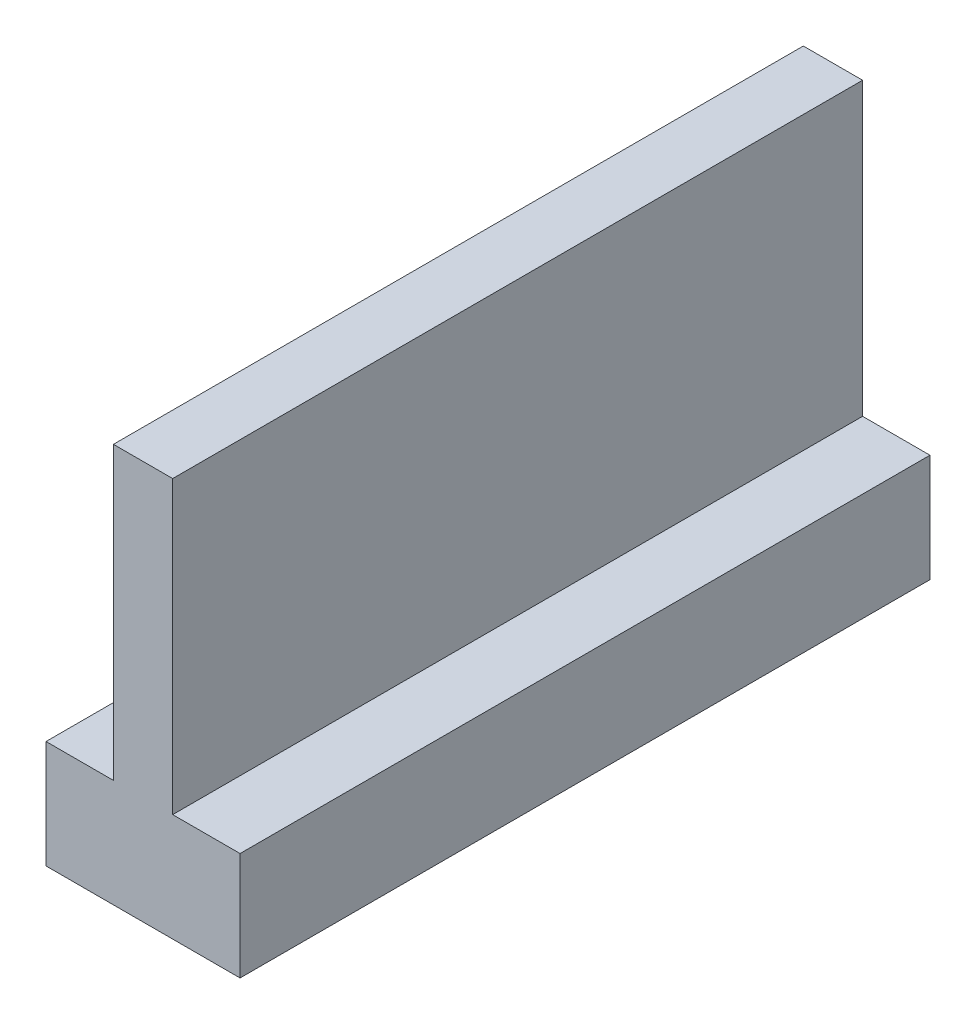
from build123d import *

# Parameters (mm, degrees)
BOSS_EXTRUDE2_DEPTH = 64


with BuildPart() as part:
    # Sketch2 → Boss-Extrude2 (new body)
    with BuildSketch(Plane.XY):
        Polygon((0, 0), (0, 10), (6.25, 10), (6.25, 37), (11.75, 37), (11.75, 10), (18, 10), (18, 0), align=None)
    extrude(amount=BOSS_EXTRUDE2_DEPTH)


solid = part.part
